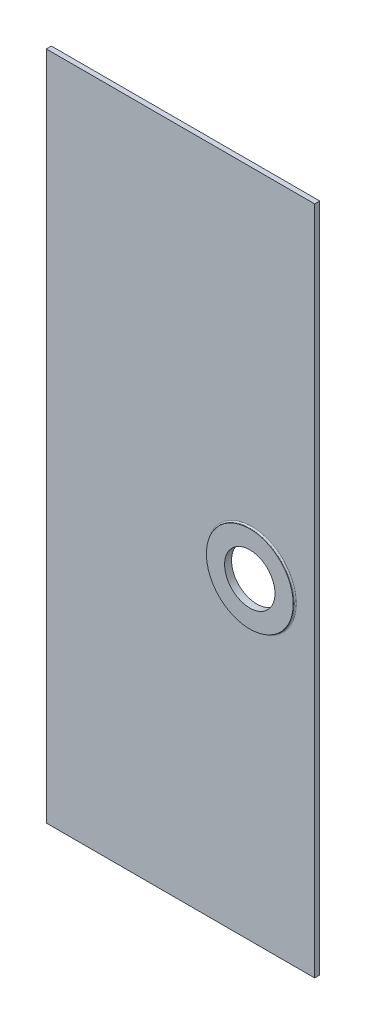
from build123d import *

# Parameters (mm, degrees)
SKETCH1_W           = 106.5
SKETCH1_H           = 266
BOSS_EXTRUDE1_DEPTH = 2
SKETCH2_R           = 10
CUT_EXTRUDE1_DEPTH  = 10
SKETCH5_R           = 17.221351736
BOSS_EXTRUDE3_DEPTH = 0.75
FILLET2_R           = 0.5
CUT_EXTRUDE3_START  = -0.75
SKETCH6_R           = 10
CUT_EXTRUDE3_DEPTH  = 0.75


with BuildPart() as part:
    # Sketch1 → Boss-Extrude1 (new body)
    with BuildSketch(Plane.XY):
        with Locations((53.25, -133)):
            Rectangle(SKETCH1_W, SKETCH1_H)
    extrude(amount=BOSS_EXTRUDE1_DEPTH)

    # Sketch2 → Cut-Extrude1 (cut)
    with BuildSketch(Plane.XY.offset(2)):
        with Locations((81.5, -141)):
            Circle(SKETCH2_R)
    extrude(amount=-CUT_EXTRUDE1_DEPTH, mode=Mode.SUBTRACT)

    # Sketch5 → Boss-Extrude3 (add)
    with BuildSketch(Plane.XY.offset(2)):
        with Locations((81.5, -141)):
            Circle(SKETCH5_R)
    extrude(amount=BOSS_EXTRUDE3_DEPTH)

    # Fillet2
    fillet2_edges = [part.edges().sort_by_distance(p)[0] for p in [
        (64.278648264, -141, 2),
    ]]
    fillet(fillet2_edges, radius=FILLET2_R)

    # Sketch6 → Cut-Extrude3 (cut)
    with BuildSketch(Plane(origin=(0, 0, 2), x_dir=(-1, 0, 0), z_dir=(0, 0, -1)).offset(CUT_EXTRUDE3_START)):
        with Locations(Location((-81.5, -141, 0), (0, 0, 180))):
            Circle(SKETCH6_R)
    extrude(amount=CUT_EXTRUDE3_DEPTH, mode=Mode.SUBTRACT)


solid = part.part
